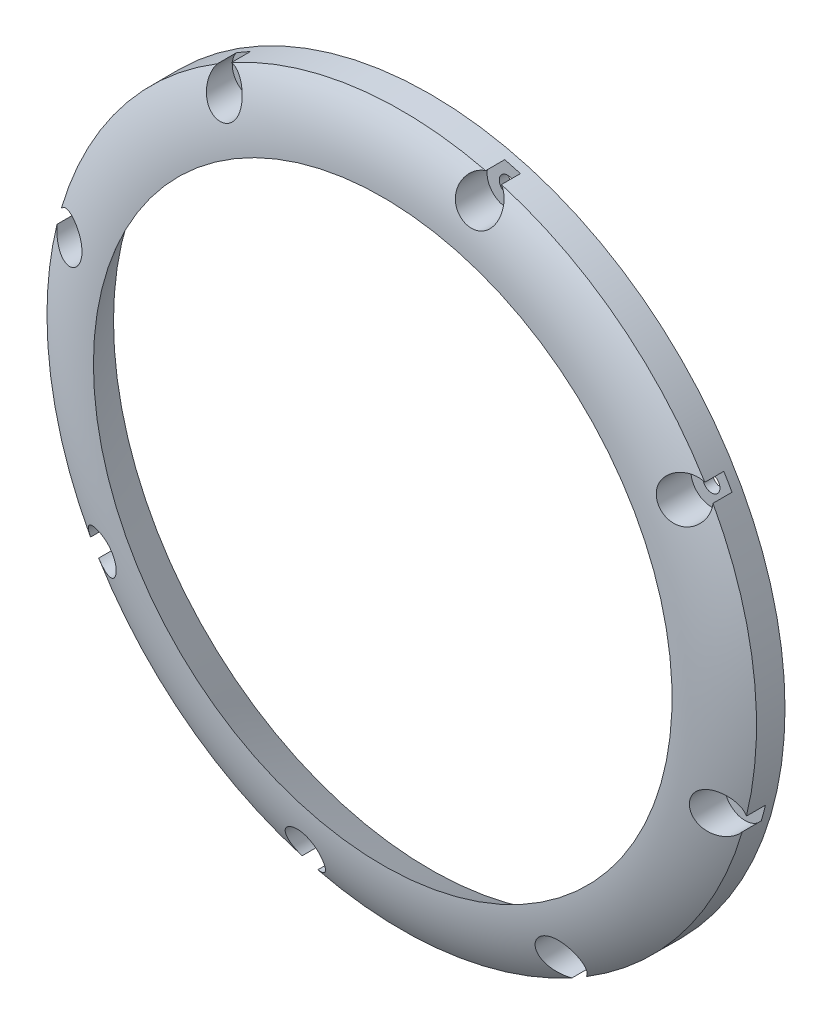
from build123d import *

# Parameters (mm, degrees)
SKETCH3_R          = 2.65
CUT_EXTRUDE1_DEPTH = 160.100597108
CUT_EXTRUDE2_START = -3
SKETCH4_R          = 6.5
CUT_EXTRUDE2_DEPTH = 157.100597258
CIRPATTERN1_COUNT  = 8


with BuildPart() as part:
    # Sketch2 → Revolve1 (revolve)
    with BuildSketch(Plane(origin=(0, 0, 0), x_dir=(1, 0, 0), z_dir=(0, 1, 0))):
        with BuildLine():
            Line((-100, 0), (-112, 0))
            Line((-112, 0), (-112, -9))
            ThreePointArc((-112, -9), (-102.096675088, -13.469639994), (-91.339745962, -15))
            Line((-91.339745962, -15), (-100, 0))
        make_face()
    revolve(axis=Axis((0, 0, 0), (0, 0, 1)))

    # Sketch3 → Cut-Extrude1 (cut, through all)
    with BuildSketch(Plane(origin=(0, 0, 0), x_dir=(-1, 0, 0), z_dir=(0, 0, -1))):
        with Locations((-102.388137587, -27.434818781)):
            Circle(SKETCH3_R)
    cut_extrude1 = extrude(amount=-CUT_EXTRUDE1_DEPTH, mode=Mode.SUBTRACT)

    # Sketch4 → Cut-Extrude2 (cut, through all)
    with BuildSketch(Plane(origin=(0, 0, 0), x_dir=(-1, 0, 0), z_dir=(0, 0, -1)).offset(CUT_EXTRUDE2_START)):
        with Locations((-102.388137587, -27.434818781)):
            Circle(SKETCH4_R)
    cut_extrude2 = extrude(amount=-CUT_EXTRUDE2_DEPTH, mode=Mode.SUBTRACT)

    # CirPattern1: Cut-Extrude1, Cut-Extrude2 ×8 about axis
    cirpattern1_axis = Axis((0, 0, 0), (0, 0, -1))
    add([cut_extrude1.rotate(cirpattern1_axis, i * 360 / CIRPATTERN1_COUNT) for i in range(1, CIRPATTERN1_COUNT)], mode=Mode.SUBTRACT)
    add([cut_extrude2.rotate(cirpattern1_axis, i * 360 / CIRPATTERN1_COUNT) for i in range(1, CIRPATTERN1_COUNT)], mode=Mode.SUBTRACT)


solid = part.part
